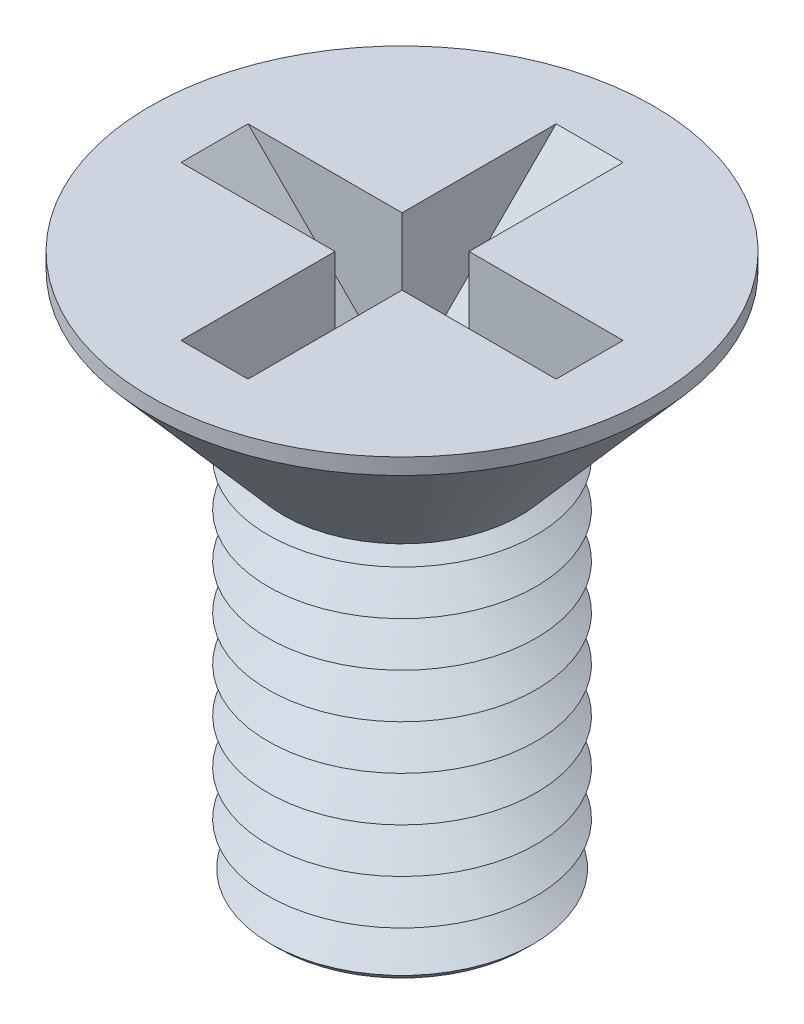
from build123d import *

# Parameters (mm, degrees)
CUT_EXTRUDE1_DEPTH = 0.1905
CIRPATTERN1_COUNT  = 4


with BuildPart() as part:
    # Sketch3 → Shank Revolve ( driven ) (revolve)
    with BuildSketch(Plane.XY, mode=Mode.PRIVATE) as shank_revolve_driven_sk:
        Polygon((0, 0), (0, -3.175), (0.6096, -3.175), (0.762, -3.0226), (0.762, 0), align=None)
    revolve(shank_revolve_driven_sk.sketch.rotate(Axis((0, -50, 0), (0, 1, 0)), 90), axis=Axis((0, -50, 0), (0, 1, 0)))

    # Sketch4 → Thread Revolve Cut ( driven ) (revolve, cut)
    with BuildSketch(Plane.XY, mode=Mode.PRIVATE) as thread_revolve_cut_driven_sk:
        Polygon((0.542029547, 0.635), (0.762, 0.762), (1.27, 0.762), (1.27, -3.81), (0.762, -3.81), (0.542029547, -3.683), (0.762, -3.556), (0.542029547, -3.429), (0.762, -3.302), (0.542029547, -3.175), (0.762, -3.048), (0.542029547, -2.921), (0.762, -2.794), (0.542029547, -2.667), (0.762, -2.54), (0.542029547, -2.413), (0.762, -2.286), (0.542029547, -2.159), (0.762, -2.032), (0.542029547, -1.905), (0.762, -1.778), (0.542029547, -1.651), (0.762, -1.524), (0.542029547, -1.397), (0.762, -1.27), (0.542029547, -1.143), (0.762, -1.016), (0.542029547, -0.889), (0.762, -0.762), (0.542029547, -0.635), (0.762, -0.508), (0.542029547, -0.381), (0.762, -0.254), (0.542029547, -0.127), (0.762, 0), (0.542029547, 0.127), (0.762, 0.254), (0.542029547, 0.381), (0.762, 0.508), align=None)
    revolve(thread_revolve_cut_driven_sk.sketch.rotate(Axis((0, -50, 0), (0, 1, 0)), 90), axis=Axis((0, -50, 0), (0, 1, 0)), mode=Mode.SUBTRACT)

    # Sketch5 → Head Revolve ( driven ) (revolve)
    with BuildSketch(Plane.XY, mode=Mode.PRIVATE) as head_revolve_driven_sk:
        Polygon((0, 0), (1.431812421, 0), (1.431812421, -0.09144), (0, -1.738551774), align=None)
    revolve(head_revolve_driven_sk.sketch.rotate(Axis((0, -50, 0), (0, 1, 0)), 90), axis=Axis((0, -50, 0), (0, 1, 0)))

    # Sketch7 → Cut-Extrude1 (cut, symmetric)
    with BuildSketch(Plane(origin=(0, 0, 0), x_dir=(0, 0, -1), z_dir=(1, 0, 0))):
        Polygon((0, 0.508), (1.5748, 0.508), (0.1905, -0.8763), (0, -0.8763), align=None)
    cut_extrude1 = extrude(amount=CUT_EXTRUDE1_DEPTH, both=True, mode=Mode.SUBTRACT)

    # CirPattern1: Cut-Extrude1 ×4 about axis
    cirpattern1_axis = Axis((0, 0, 0), (0, 1, 0))
    for i in range(1, CIRPATTERN1_COUNT):
        add(cut_extrude1.rotate(cirpattern1_axis, i * 360 / CIRPATTERN1_COUNT), mode=Mode.SUBTRACT)


solid = part.part
